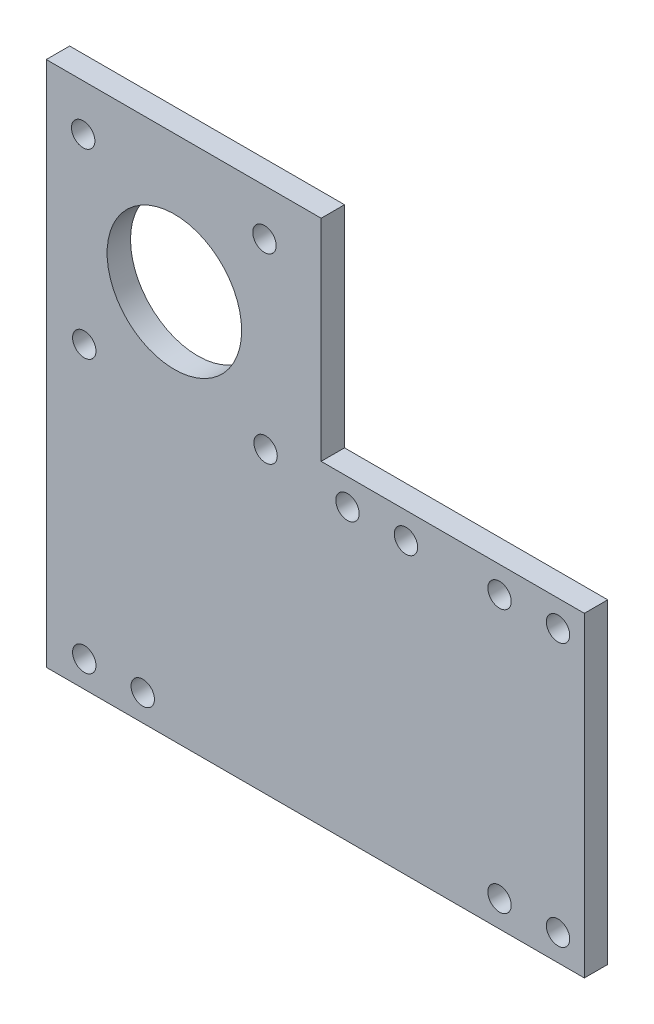
from build123d import *

# Parameters (mm, degrees)
BOSS_EXTRUDE1_DEPTH = 4
SKETCH2_R           = 2
CUT_EXTRUDE1_DEPTH  = 4
SKETCH3_R           = 2
CUT_EXTRUDE2_DEPTH  = 4
SKETCH4_R           = 2
CUT_EXTRUDE3_DEPTH  = 4
SKETCH5_W           = 2
SKETCH5_H           = 90
BOSS_EXTRUDE2_DEPTH = 4
SKETCH6_R           = 2
CUT_EXTRUDE4_DEPTH  = 4
SKETCH7_R           = 11.5
CUT_EXTRUDE5_DEPTH  = 10


with BuildPart() as part:
    # Sketch1 → Boss-Extrude1 (new body)
    with BuildSketch(Plane.XY):
        Polygon((-45, 27), (-45, 63), (0, 63), (0, 27), (45, 27), (45, -27), (-45, -27), align=None)
    extrude(amount=BOSS_EXTRUDE1_DEPTH)

    # Sketch2 → Cut-Extrude1 (cut)
    with BuildSketch(Plane.XY.offset(4)):
        with Locations((-40.5, -22.5)):
            Circle(SKETCH2_R)
        with Locations((-30.5, -22.5)):
            Circle(SKETCH2_R)
        with Locations(Location((30.5, -22.5, 0), (0, 0, 180))):
            Circle(SKETCH2_R)
        with Locations(Location((40.5, -22.5, 0), (0, 0, 180))):
            Circle(SKETCH2_R)
        with Locations(Location((30.5, 22.5, 0), (0, 0, 180))):
            Circle(SKETCH2_R)
        with Locations(Location((40.5, 22.5, 0), (0, 0, 180))):
            Circle(SKETCH2_R)
    extrude(amount=-CUT_EXTRUDE1_DEPTH, mode=Mode.SUBTRACT)

    # Sketch3 → Cut-Extrude2 (cut)
    with BuildSketch(Plane.XY.offset(4)):
        with Locations((-40.5, 24.080850084)):
            Circle(SKETCH3_R)
        with Locations((-9.500034607, 24.034529107)):
            Circle(SKETCH3_R)
    extrude(amount=-CUT_EXTRUDE2_DEPTH, mode=Mode.SUBTRACT)

    # Sketch4 → Cut-Extrude3 (cut)
    with BuildSketch(Plane.XY.offset(4)):
        with Locations((-40.690838772, 55.080850084)):
            Circle(SKETCH4_R)
        with Locations((-9.690838772, 55.080850084)):
            Circle(SKETCH4_R)
    extrude(amount=-CUT_EXTRUDE3_DEPTH, mode=Mode.SUBTRACT)

    # Sketch5 → Boss-Extrude2 (add)
    with BuildSketch(Plane.XY.offset(4)):
        with Locations((-46, 18)):
            Rectangle(SKETCH5_W, SKETCH5_H)
    extrude(amount=-BOSS_EXTRUDE2_DEPTH)

    # Sketch6 → Cut-Extrude4 (cut)
    with BuildSketch(Plane.XY.offset(4)):
        with Locations((4.5, 22.5)):
            Circle(SKETCH6_R)
        with Locations((14.5, 22.5)):
            Circle(SKETCH6_R)
    extrude(amount=-CUT_EXTRUDE4_DEPTH, mode=Mode.SUBTRACT)

    # Sketch7 → Cut-Extrude5 (cut)
    with BuildSketch(Plane.XY.offset(4)):
        with Locations((-25.09543669, 39.557689595)):
            Circle(SKETCH7_R)
    extrude(amount=-CUT_EXTRUDE5_DEPTH, mode=Mode.SUBTRACT)


solid = part.part
